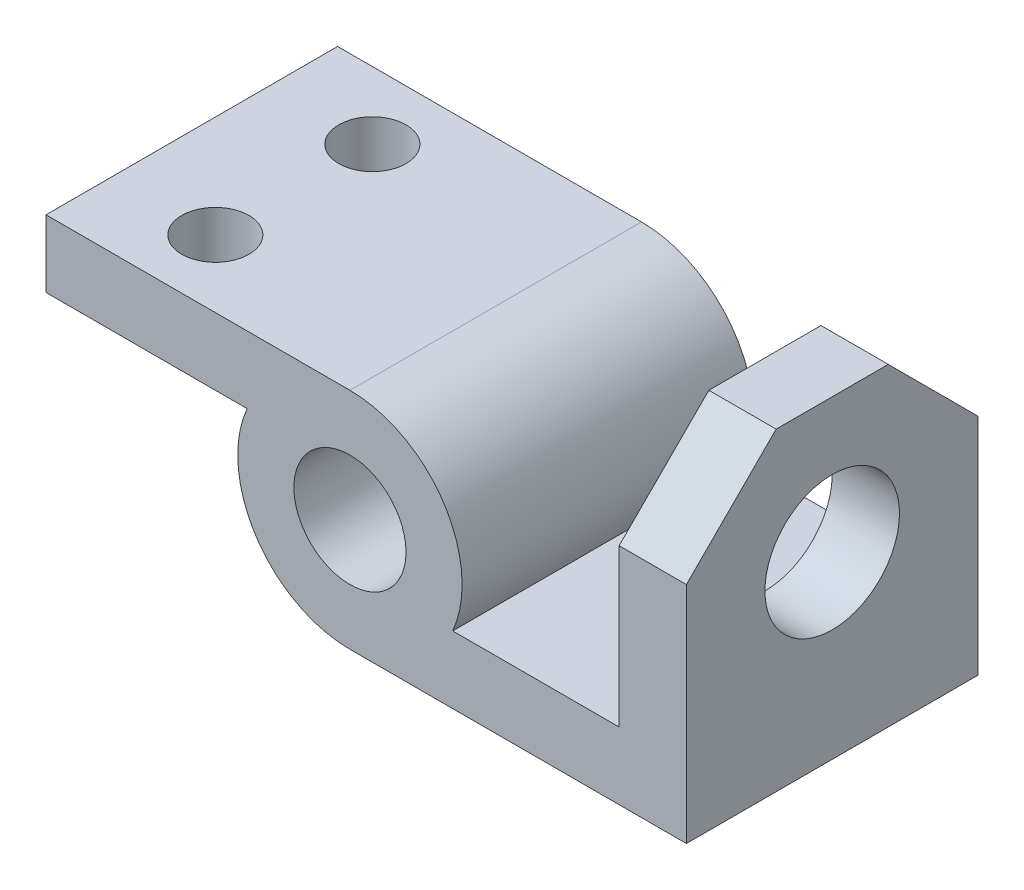
from build123d import *

# Parameters (mm, degrees)
BOSS_EXTRUDE2_DEPTH            = 1.625
SKETCH4_W                      = 3.25
SKETCH4_H                      = 3.5
BOSS_EXTRUDE3_DEPTH            = 0.75
CHAMFER1_SIZE                  = 1
F_1_25_1_25_DIAMETER_HOLE1_D   = 1.25
F_1_5_1_5_DIAMETER_HOLE1_D     = 1.5
F_1_5_1_5_DIAMETER_HOLE1_DEPTH = 0.75
F_0_75_0_75_DIAMETER_HOLE1_D   = 0.75


with BuildPart() as part:
    # Sketch3 → Boss-Extrude2 (new, symmetric)
    with BuildSketch(Plane.XY):
        with BuildLine():
            Line((0, 1.25), (-3.3875, 1.25))
            Line((-3.3875, 1.25), (-3.3875, 0.5))
            Line((-3.3875, 0.5), (-1.145643924, 0.5))
            ThreePointArc((-1.145643924, 0.5), (-1.045825033, -0.684653197), (0, -1.25))
            Line((0, -1.25), (3.75, -1.25))
            Line((3.75, -1.25), (3.75, -0.5))
            Line((3.75, -0.5), (1.145643924, -0.5))
            ThreePointArc((1.145643924, -0.5), (1.045825033, 0.684653197), (0, 1.25))
        make_face()
    extrude(amount=BOSS_EXTRUDE2_DEPTH, both=True)

    # Sketch4 → Boss-Extrude3 (add)
    with BuildSketch(Plane(origin=(3.75, 0, 0), x_dir=(0, 0, -1), z_dir=(1, 0, 0))):
        with Locations((0, 0.5)):
            Rectangle(SKETCH4_W, SKETCH4_H)
    extrude(amount=-BOSS_EXTRUDE3_DEPTH)

    # Chamfer1
    chamfer1_edges = [part.edges().sort_by_distance(p)[0] for p in [
        (3.375, 2.25, -1.625),
        (3.375, 2.25, 1.625),
    ]]
    chamfer(chamfer1_edges, length=CHAMFER1_SIZE)

    # Ø1.25 (1.25) Diameter Hole1 (through all)
    with Locations(Plane.XY.offset(1.625)):
        with Locations((0, 0)):
            Hole(F_1_25_1_25_DIAMETER_HOLE1_D / 2)

    # Ø1.5 (1.5) Diameter Hole1
    with Locations(Plane(origin=(3.75, 0, 0), x_dir=(0, 0, -1), z_dir=(1, 0, 0))):
        with Locations((0, 0.75)):
            Hole(F_1_5_1_5_DIAMETER_HOLE1_D / 2, depth=F_1_5_1_5_DIAMETER_HOLE1_DEPTH)

    # Ø0.75 (0.75) Diameter Hole1 (through all)
    with Locations(Plane(origin=(0, 1.25, 0), x_dir=(1, 0, 0), z_dir=(0, 1, 0))):
        with Locations((-2.25, 0.875)):
            f_0_75_0_75_diameter_hole1 = Hole(F_0_75_0_75_DIAMETER_HOLE1_D / 2)

    # Mirror1: Ø0.75 (0.75) Diameter Hole1 across plane
    add(f_0_75_0_75_diameter_hole1.mirror(Plane.XY), mode=Mode.SUBTRACT)


solid = part.part
